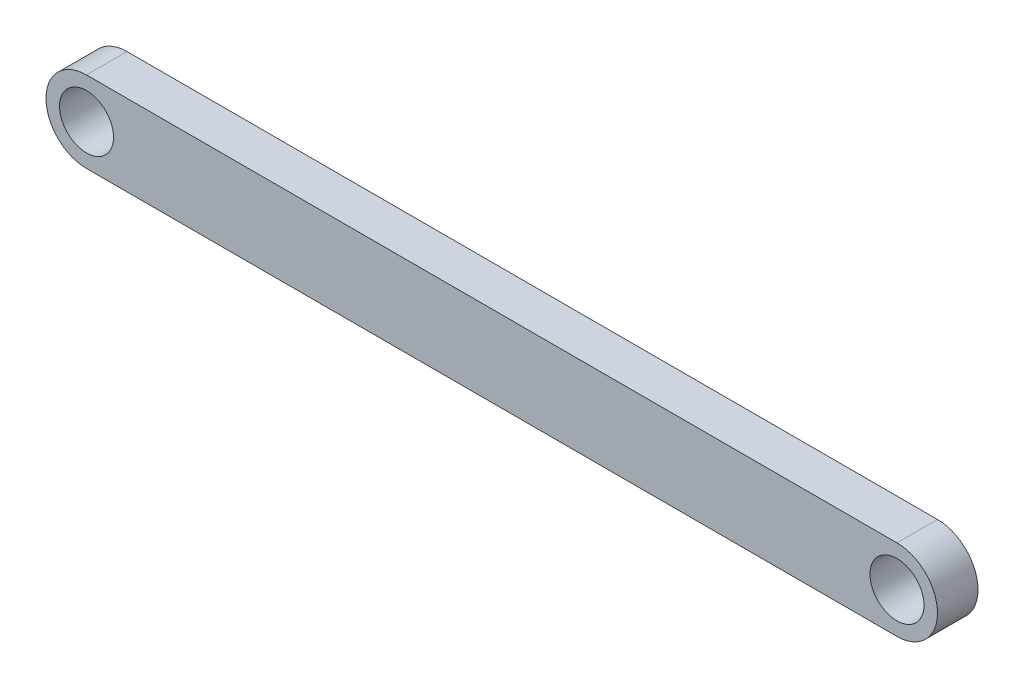
from build123d import *

# Parameters (mm, degrees)
SKETCH1_R      = 10
EXTRUDE1_DEPTH = 15


with BuildPart() as part:
    # Sketch1 → Extrude1 (new body)
    with BuildSketch(Plane.XY):
        with BuildLine():
            Line((-300, 15), (0, 15))
            ThreePointArc((0, 15), (15, 0), (0, -15))
            Line((0, -15), (-300, -15))
            ThreePointArc((-300, -15), (-315, 0), (-300, 15))
        make_face()
        with Locations((-300, 0)):
            Circle(SKETCH1_R, mode=Mode.SUBTRACT)
        Circle(SKETCH1_R, mode=Mode.SUBTRACT)
    extrude(amount=EXTRUDE1_DEPTH)


solid = part.part
